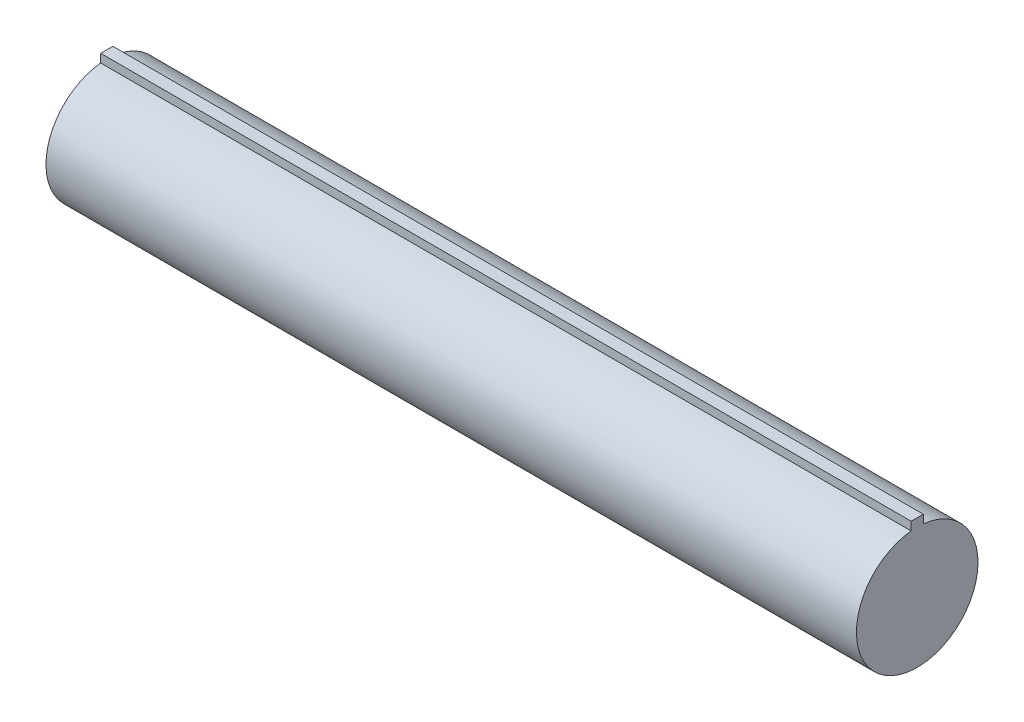
from build123d import *

# Parameters (mm, degrees)
EXTRUDE_1_DEPTH = 100


with BuildPart() as part:
    # 草图1 → 凸台-拉伸1 (new, symmetric)
    with BuildSketch(Plane(origin=(0, 0, 0), x_dir=(0, 0, -1), z_dir=(1, 0, 0))):
        with BuildLine():
            Line((-1.5, 14.924811557), (-1.5, 0))
            Line((-1.5, 0), (1.5, 0))
            Line((1.5, 0), (1.5, 14.924811557))
            ThreePointArc((1.5, 14.924811557), (0, 15), (-1.5, 14.924811557))
        make_face()
        with BuildLine():
            Line((1.5, 0), (-1.5, 0))
            Line((-1.5, 0), (-1.5, 14.924811557))
            ThreePointArc((-1.5, 14.924811557), (-10.062305899, -11.124297731), (15, 0))
            ThreePointArc((15, 0), (11.124297731, 10.062305899), (1.5, 14.924811557))
            Line((1.5, 14.924811557), (1.5, 0))
        make_face()
        with BuildLine():
            Line((-1.5, 17), (-1.5, 14.924811557))
            ThreePointArc((-1.5, 14.924811557), (0, 15), (1.5, 14.924811557))
            Line((1.5, 14.924811557), (1.5, 17))
            Line((1.5, 17), (-1.5, 17))
        make_face()
    extrude(amount=EXTRUDE_1_DEPTH, both=True)


solid = part.part
